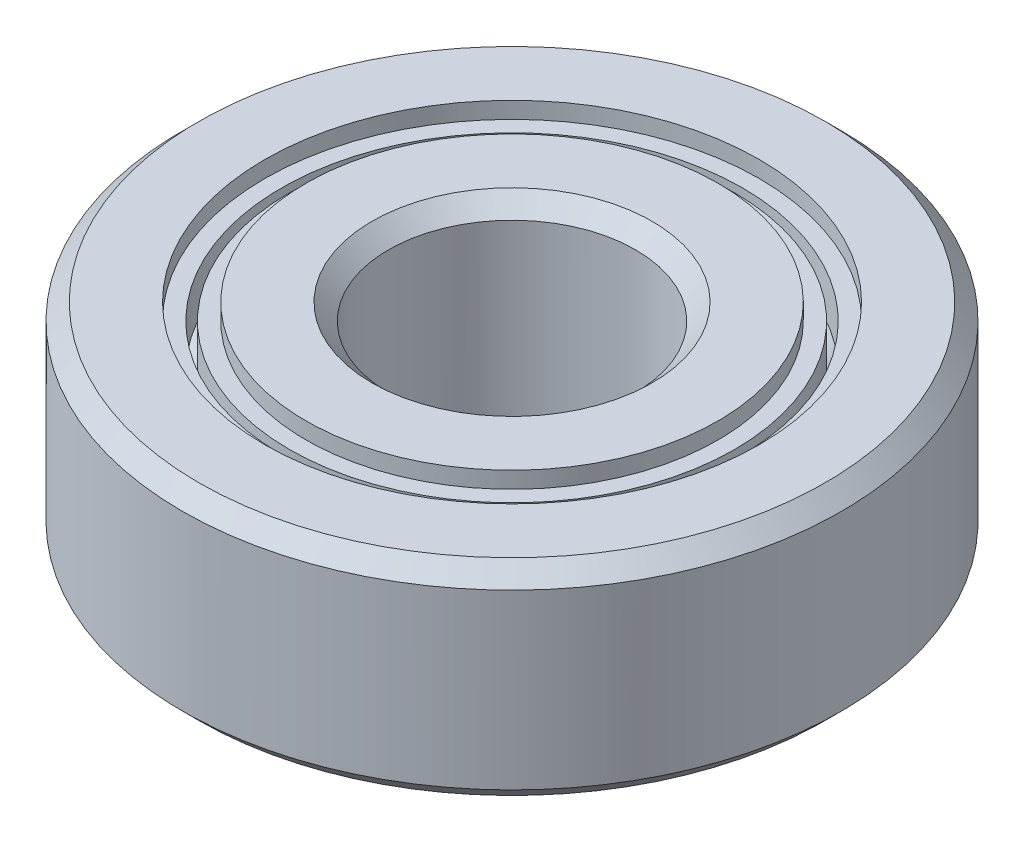
from build123d import *

# Parameters (mm, degrees)
CIRPATTERN2_COUNT = 17
CHAMFER1_SIZE     = 0.2
CHAMFER2_SIZE     = 0.2


with BuildPart() as part:
    # Sketch1 → Revolve1 (revolve)
    with BuildSketch(Plane(origin=(0, 0, 0), x_dir=(0, 0, -1), z_dir=(1, 0, 0))):
        with BuildLine():
            Line((1.5, -0.25), (2.5, -0.25))
            Line((2.5, -0.25), (2.5, -0.049454287))
            Line((2.5, -0.049454287), (2.7, -0.049454287))
            Line((2.7, -0.049454287), (2.7, 0.477386376))
            ThreePointArc((2.7, 0.477386376), (2.225, 1), (2.7, 1.522613624))
            Line((2.7, 1.522613624), (2.7, 2.049454287))
            Line((2.7, 2.049454287), (2.5, 2.049454287))
            Line((2.5, 2.049454287), (2.5, 2.25))
            Line((2.5, 2.25), (1.5, 2.25))
            Line((1.5, 2.25), (1.5, -0.25))
        make_face()
        with BuildLine():
            Line((4, -0.25), (4, 2.25))
            Line((4, 2.25), (3, 2.25))
            Line((3, 2.25), (3, 2.049454287))
            Line((3, 2.049454287), (2.8, 2.049454287))
            Line((2.8, 2.049454287), (2.8, 1.522613624))
            ThreePointArc((2.8, 1.522613624), (3.275, 1), (2.8, 0.477386376))
            Line((2.8, 0.477386376), (2.8, -0.049454287))
            Line((2.8, -0.049454287), (3, -0.049454287))
            Line((3, -0.049454287), (3, -0.25))
            Line((3, -0.25), (4, -0.25))
        make_face()
    revolve(axis=Axis((0, 0, 0), (0, 1, 0)))

    # Chamfer1
    chamfer1_edges = [part.edges().sort_by_distance(p)[0] for p in [
        (0, 2.25, 4),
        (0, -0.25, 4),
    ]]
    chamfer(chamfer1_edges, length=CHAMFER1_SIZE)

    # Chamfer2
    chamfer2_edges = [part.edges().sort_by_distance(p)[0] for p in [
        (0, -0.25, 1.5),
        (0, 2.25, 1.5),
    ]]
    chamfer(chamfer2_edges, length=CHAMFER2_SIZE)


with BuildPart() as body_2:
    # Sketch2 → Revolve2 (revolve)
    with BuildSketch(Plane.XY):
        with BuildLine():
            Line((2.75, 1.5), (2.75, 0.5))
            ThreePointArc((2.75, 0.5), (3.25, 1), (2.75, 1.5))
        make_face()
    revolve(axis=Axis((2.75, -0.235597703, 0), (0, 1, 0)))


with BuildPart() as cirpattern2_1:
    # CirPattern2: pattern copy
    add(body_2.part.rotate(Axis((0, 0, 0), (0, 1, 0)), 1 * 360 / CIRPATTERN2_COUNT))


with BuildPart() as cirpattern2_2:
    # CirPattern2: pattern copy
    add(body_2.part.rotate(Axis((0, 0, 0), (0, 1, 0)), 2 * 360 / CIRPATTERN2_COUNT))


with BuildPart() as cirpattern2_3:
    # CirPattern2: pattern copy
    add(body_2.part.rotate(Axis((0, 0, 0), (0, 1, 0)), 3 * 360 / CIRPATTERN2_COUNT))


with BuildPart() as cirpattern2_4:
    # CirPattern2: pattern copy
    add(body_2.part.rotate(Axis((0, 0, 0), (0, 1, 0)), 4 * 360 / CIRPATTERN2_COUNT))


with BuildPart() as cirpattern2_5:
    # CirPattern2: pattern copy
    add(body_2.part.rotate(Axis((0, 0, 0), (0, 1, 0)), 5 * 360 / CIRPATTERN2_COUNT))


with BuildPart() as cirpattern2_6:
    # CirPattern2: pattern copy
    add(body_2.part.rotate(Axis((0, 0, 0), (0, 1, 0)), 6 * 360 / CIRPATTERN2_COUNT))


with BuildPart() as cirpattern2_7:
    # CirPattern2: pattern copy
    add(body_2.part.rotate(Axis((0, 0, 0), (0, 1, 0)), 7 * 360 / CIRPATTERN2_COUNT))


with BuildPart() as cirpattern2_8:
    # CirPattern2: pattern copy
    add(body_2.part.rotate(Axis((0, 0, 0), (0, 1, 0)), 8 * 360 / CIRPATTERN2_COUNT))


with BuildPart() as cirpattern2_9:
    # CirPattern2: pattern copy
    add(body_2.part.rotate(Axis((0, 0, 0), (0, 1, 0)), 9 * 360 / CIRPATTERN2_COUNT))


with BuildPart() as cirpattern2_10:
    # CirPattern2: pattern copy
    add(body_2.part.rotate(Axis((0, 0, 0), (0, 1, 0)), 10 * 360 / CIRPATTERN2_COUNT))


with BuildPart() as cirpattern2_11:
    # CirPattern2: pattern copy
    add(body_2.part.rotate(Axis((0, 0, 0), (0, 1, 0)), 11 * 360 / CIRPATTERN2_COUNT))


with BuildPart() as cirpattern2_12:
    # CirPattern2: pattern copy
    add(body_2.part.rotate(Axis((0, 0, 0), (0, 1, 0)), 12 * 360 / CIRPATTERN2_COUNT))


with BuildPart() as cirpattern2_13:
    # CirPattern2: pattern copy
    add(body_2.part.rotate(Axis((0, 0, 0), (0, 1, 0)), 13 * 360 / CIRPATTERN2_COUNT))


with BuildPart() as cirpattern2_14:
    # CirPattern2: pattern copy
    add(body_2.part.rotate(Axis((0, 0, 0), (0, 1, 0)), 14 * 360 / CIRPATTERN2_COUNT))


with BuildPart() as cirpattern2_15:
    # CirPattern2: pattern copy
    add(body_2.part.rotate(Axis((0, 0, 0), (0, 1, 0)), 15 * 360 / CIRPATTERN2_COUNT))


with BuildPart() as cirpattern2_16:
    # CirPattern2: pattern copy
    add(body_2.part.rotate(Axis((0, 0, 0), (0, 1, 0)), 16 * 360 / CIRPATTERN2_COUNT))


solid = Compound([part.part, body_2.part, cirpattern2_1.part, cirpattern2_2.part, cirpattern2_3.part, cirpattern2_4.part, cirpattern2_5.part, cirpattern2_6.part, cirpattern2_7.part, cirpattern2_8.part, cirpattern2_9.part, cirpattern2_10.part, cirpattern2_11.part, cirpattern2_12.part, cirpattern2_13.part, cirpattern2_14.part, cirpattern2_15.part, cirpattern2_16.part])
